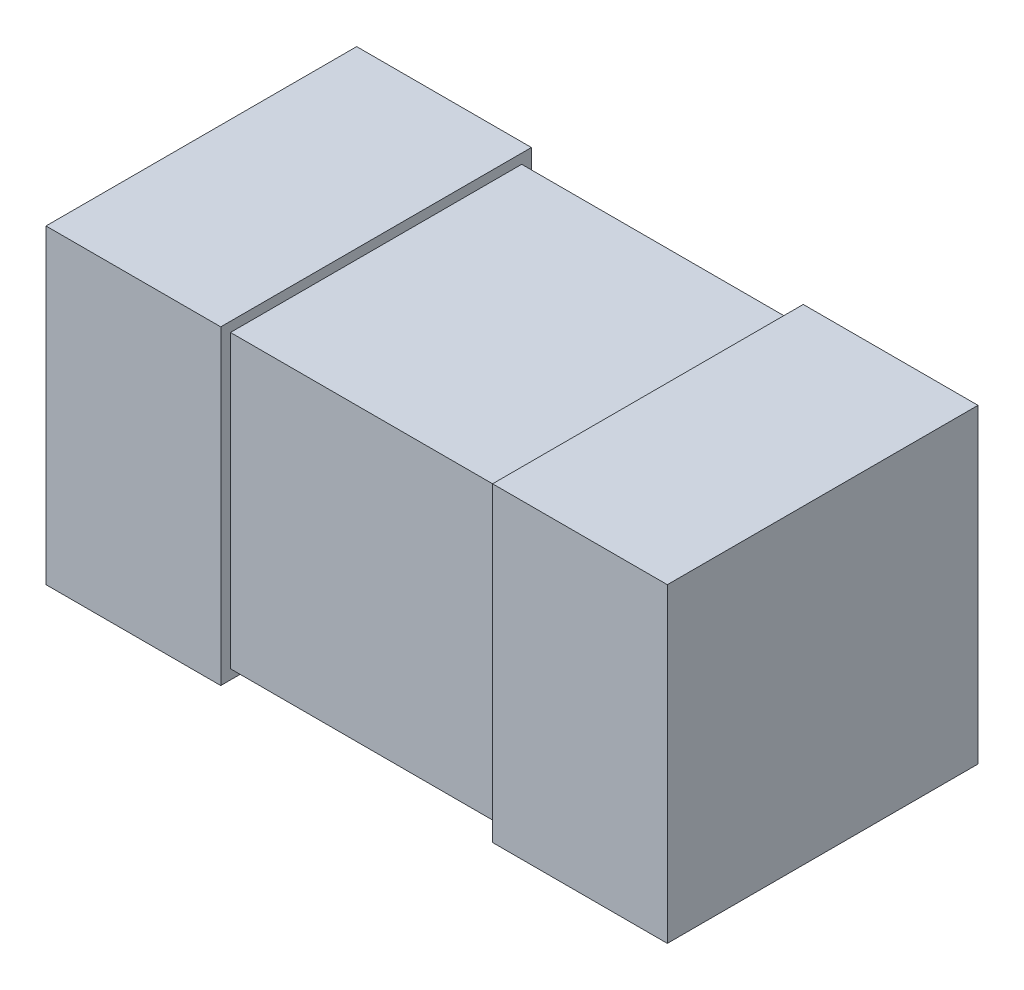
from build123d import *

# Parameters (mm, degrees)
SKETCH1_W             = 0.9
SKETCH1_H             = 1.6
BOSS_EXTRUDE1_DEPTH   = 1.6
BOSS_EXTRUDE1_2_DEPTH = 1.6
BOSS_EXTRUDE2_REACH   = 5.226
SKETCH2_W             = 1.5
SKETCH2_H             = 1.5


with BuildPart() as part:
    # Sketch1 → Boss-Extrude1 (new body)
    with BuildSketch(Plane(origin=(0, 0, 0), x_dir=(1, 0, 0), z_dir=(0, 1, 0))):
        with Locations((0.45, 0.8)):
            Rectangle(SKETCH1_W, SKETCH1_H)
    extrude(amount=BOSS_EXTRUDE1_DEPTH)


with BuildPart() as body_2:
    # Sketch1 → Boss-Extrude1 2 (new body)
    with BuildSketch(Plane(origin=(0, 0, 0), x_dir=(1, 0, 0), z_dir=(0, 1, 0))):
        with Locations((2.75, 0.8)):
            Rectangle(SKETCH1_W, SKETCH1_H)
    extrude(amount=BOSS_EXTRUDE1_2_DEPTH)

    # Sketch2 → Boss-Extrude2 (add, up to next)
    with BuildSketch(Plane(origin=(0.9, 0, 0), x_dir=(0, 0, -1), z_dir=(1, 0, 0)), mode=Mode.PRIVATE) as boss_extrude2_sk1:
        with Locations((0.8, 0.8)):
            Rectangle(SKETCH2_W, SKETCH2_H)
    boss_extrude2_tool1 = extrude(boss_extrude2_sk1.sketch, amount=BOSS_EXTRUDE2_REACH, mode=Mode.PRIVATE) - body_2.part

    add(part.part)  # Boss-Extrude2 merges part
    add(boss_extrude2_tool1.solids().sort_by_distance((0.9, 0.8, -0.8))[0])


solid = body_2.part
